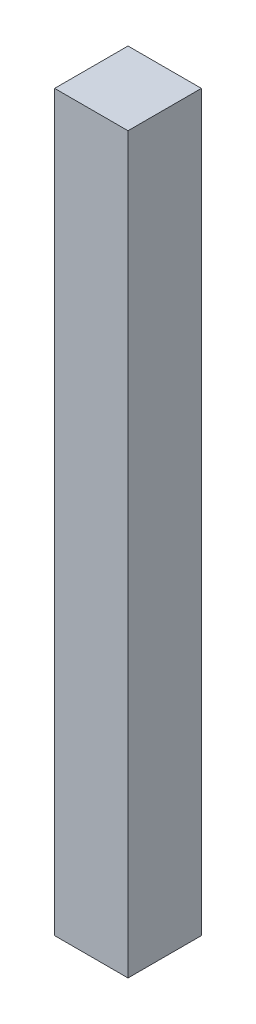
from build123d import *

# Parameters (mm, degrees)
ESQUISSE1_W        = 5
ESQUISSE1_H        = 50
BOSS_EXTRU_1_DEPTH = 5


with BuildPart() as part:
    # Esquisse1 → Boss.-Extru.1 (new body)
    with BuildSketch(Plane.XY):
        with Locations((-27.414384937, 1.844919786)):
            Rectangle(ESQUISSE1_W, ESQUISSE1_H)
    extrude(amount=BOSS_EXTRU_1_DEPTH)


solid = part.part
